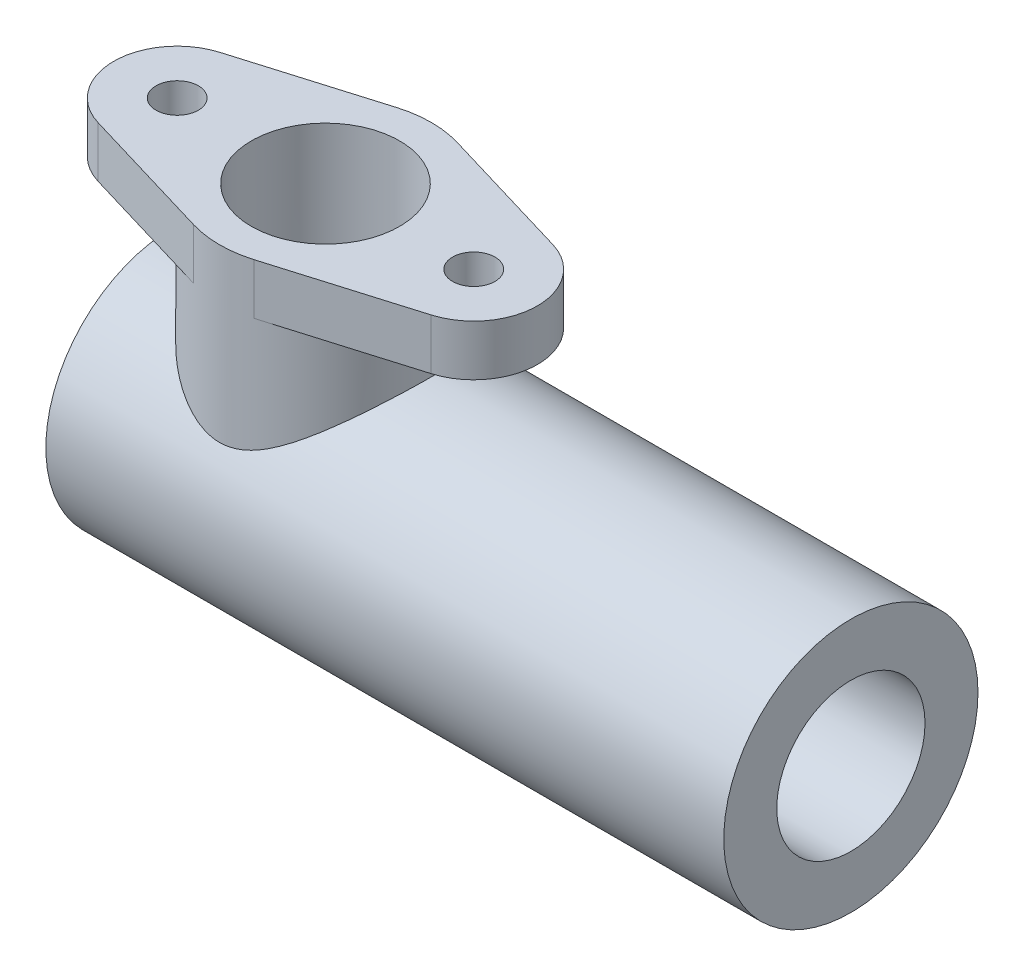
from build123d import *
from build123d.topology import SkipClean

# Parameters (mm, degrees)
SKETCH_1_R           = 17.5
SKETCH_1_R_2         = 5
EXTRUDE_1_DEPTH      = 12
EXTRUDE_3_DEPTH      = 124
EXTRUDE_3_DEPTH_BACK = 36
SKETCH_3_R           = 30
SKETCH_3_R_2         = 17.5
EXTRUDE_2_REACH      = 149.99
SKETCH_2_R           = 25
SKETCH_2_R_2         = 17.5
SKETCH_4_R           = 22
CUT_EXTRUDE_1_DEPTH  = 50
SKETCH_5_R           = 17.5
CUT_EXTRUDE_8_DEPTH  = 57


with BuildPart() as part:
    # 草图1 → 凸台-拉伸1 (new body)
    with BuildSketch(Plane(origin=(0, 0, 0), x_dir=(1, 0, 0), z_dir=(0, 1, 0))):
        with BuildLine():
            ThreePointArc((-7.142857143, 23.957871187), (0, 25), (7.142857143, 23.957871187))
            Line((7.142857143, 23.957871187), (39.285714286, 14.374722712))
            ThreePointArc((39.285714286, 14.374722712), (50, 0), (39.285714286, -14.374722712))
            Line((39.285714286, -14.374722712), (7.142857143, -23.957871187))
            ThreePointArc((7.142857143, -23.957871187), (0, -25), (-7.142857143, -23.957871187))
            Line((-7.142857143, -23.957871187), (-39.285714286, -14.374722712))
            ThreePointArc((-39.285714286, -14.374722712), (-50, 0), (-39.285714286, 14.374722712))
            Line((-39.285714286, 14.374722712), (-7.142857143, 23.957871187))
        make_face()
        with Locations(Location((0, 0, 0), (0, 0, 270))):
            Circle(SKETCH_1_R, mode=Mode.SUBTRACT)
        with Locations(Location((-35, 0, 0), (0, 0, 270))):
            Circle(SKETCH_1_R_2, mode=Mode.SUBTRACT)
        with Locations(Location((35, 0, 0), (0, 0, 270))):
            Circle(SKETCH_1_R_2, mode=Mode.SUBTRACT)
    extrude(amount=EXTRUDE_1_DEPTH)



with BuildPart() as body_2:
    # 草图3 → 凸台-拉伸3 (new, two sides: drawn at the far end of the back side and taken through both)
    with BuildSketch(Plane(origin=(0, 0, 0), x_dir=(0, 0, -1), z_dir=(1, 0, 0)).offset(-EXTRUDE_3_DEPTH_BACK)):
        with Locations((0, -45)):
            Circle(SKETCH_3_R)
        with Locations((0, -45)):
            Circle(SKETCH_3_R_2, mode=Mode.SUBTRACT)
    extrude(amount=EXTRUDE_3_DEPTH + EXTRUDE_3_DEPTH_BACK)


with BuildPart() as part_1:
    add(part.part)

    # 草图2 → 凸台-拉伸2 (add, up to next)
    with BuildSketch(Plane.XZ, mode=Mode.PRIVATE) as extrude_2_sk1:
        with Locations(Location((0, 0, 0), (0, 0, 286.601549599))):
            Circle(SKETCH_2_R)
        with Locations(Location((0, 0, 0), (0, 0, 90))):
            Circle(SKETCH_2_R_2, mode=Mode.SUBTRACT)
    extrude_2_tool1 = extrude(extrude_2_sk1.sketch, amount=EXTRUDE_2_REACH, mode=Mode.PRIVATE) - body_2.part
    add(extrude_2_tool1.solids().sort_by_distance((-6.940827, 0, 23.28024))[0])


with BuildPart() as body_2_1:
    add(body_2.part)

    # 草图4 → 切除-拉伸1 (cut, symmetric)
    with BuildSketch(Plane(origin=(44, 0, 0), x_dir=(0, 0, -1), z_dir=(1, 0, 0))):
        with Locations((0, -45)):
            Circle(SKETCH_4_R)
    extrude(amount=CUT_EXTRUDE_1_DEPTH, both=True, mode=Mode.SUBTRACT)

    # 草图5 → 切除-拉伸8 (cut)
    with BuildSketch(Plane(origin=(0, 12, 0), x_dir=(1, 0, 0), z_dir=(0, 1, 0))):
        with Locations(Location((0, 0, 0), (0, 0, 270))):
            Circle(SKETCH_5_R)
    extrude(amount=-CUT_EXTRUDE_8_DEPTH, mode=Mode.SUBTRACT)


solid = Compound([part_1.part, body_2_1.part])
